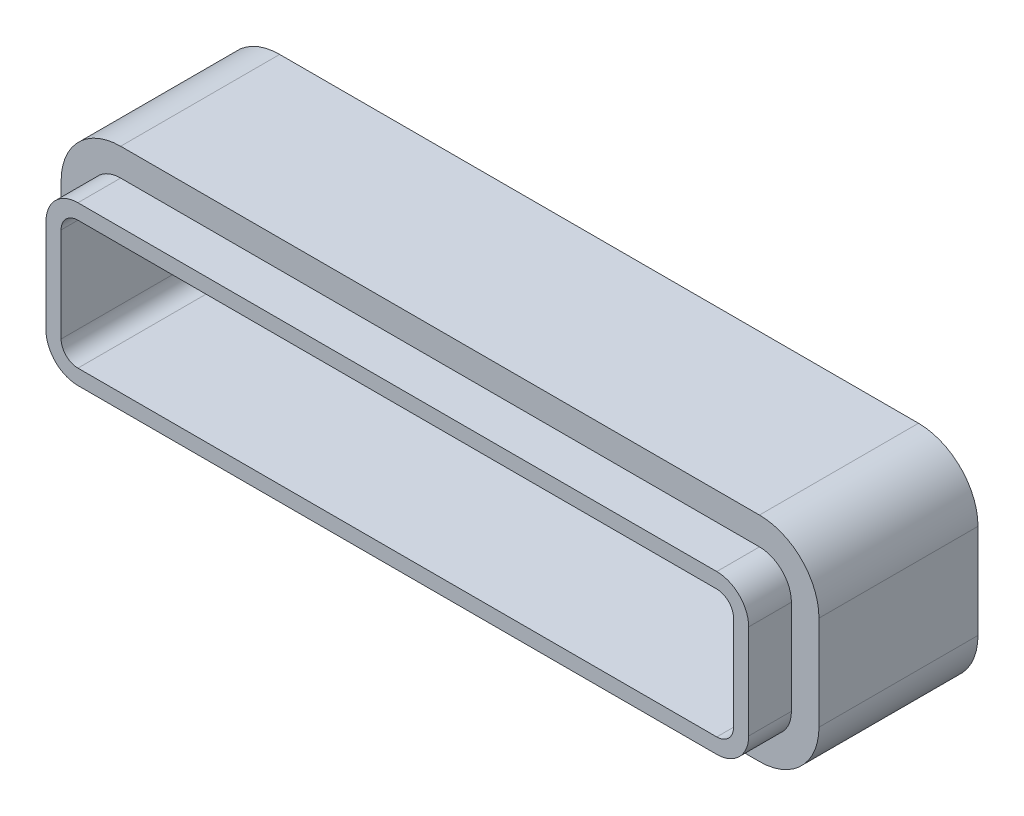
from build123d import *

# Parameters (mm, degrees)
BOSS_EXTRU_1_DEPTH = 47.3
BOSS_EXTRU_2_DEPTH = 12.7


with BuildPart() as part:
    # Esquisse1 → Boss.-Extru.1 (new body)
    with BuildSketch(Plane.XY):
        with BuildLine():
            Line((-95, -31.75), (95, -31.75))
            ThreePointArc((95, -31.75), (107.515790027, -26.565790027), (112.7, -14.05))
            Line((112.7, -14.05), (112.7, 14.05))
            ThreePointArc((112.7, 14.05), (107.515790027, 26.565790027), (95, 31.75))
            Line((95, 31.75), (-95, 31.75))
            ThreePointArc((-95, 31.75), (-107.515790027, 26.565790027), (-112.7, 14.05))
            Line((-112.7, 14.05), (-112.7, -14.05))
            ThreePointArc((-112.7, -14.05), (-107.515790027, -26.565790027), (-95, -31.75))
        make_face()
        with BuildLine():
            Line((-95, -19.05), (95, -19.05))
            ThreePointArc((95, -19.05), (98.535533906, -17.585533906), (100, -14.05))
            Line((100, -14.05), (100, 14.05))
            ThreePointArc((100, 14.05), (98.535533906, 17.585533906), (95, 19.05))
            Line((95, 19.05), (-95, 19.05))
            ThreePointArc((-95, 19.05), (-98.535533906, 17.585533906), (-100, 14.05))
            Line((-100, 14.05), (-100, -14.05))
            ThreePointArc((-100, -14.05), (-98.535533906, -17.585533906), (-95, -19.05))
        make_face(mode=Mode.SUBTRACT)
    extrude(amount=BOSS_EXTRU_1_DEPTH)

    # Esquisse2 → Boss.-Extru.2 (add)
    with BuildSketch(Plane.XY.offset(47.3)):
        with BuildLine():
            Line((-104.5, 14.05), (-104.5, -14.05))
            ThreePointArc((-104.5, -14.05), (-101.717514421, -20.767514421), (-95, -23.55))
            Line((-95, -23.55), (95, -23.55))
            ThreePointArc((95, -23.55), (101.717514421, -20.767514421), (104.5, -14.05))
            Line((104.5, -14.05), (104.5, 14.05))
            ThreePointArc((104.5, 14.05), (101.717514421, 20.767514421), (95, 23.55))
            Line((95, 23.55), (-95, 23.55))
            ThreePointArc((-95, 23.55), (-101.717514421, 20.767514421), (-104.5, 14.05))
        make_face()
        with BuildLine():
            Line((100, -14.05), (100, 14.05))
            ThreePointArc((100, 14.05), (98.535533906, 17.585533906), (95, 19.05))
            Line((95, 19.05), (-95, 19.05))
            ThreePointArc((-95, 19.05), (-98.535533906, 17.585533906), (-100, 14.05))
            Line((-100, 14.05), (-100, -14.05))
            ThreePointArc((-100, -14.05), (-98.535533906, -17.585533906), (-95, -19.05))
            Line((-95, -19.05), (95, -19.05))
            ThreePointArc((95, -19.05), (98.535533906, -17.585533906), (100, -14.05))
        make_face(mode=Mode.SUBTRACT)
    extrude(amount=BOSS_EXTRU_2_DEPTH)


solid = part.part
